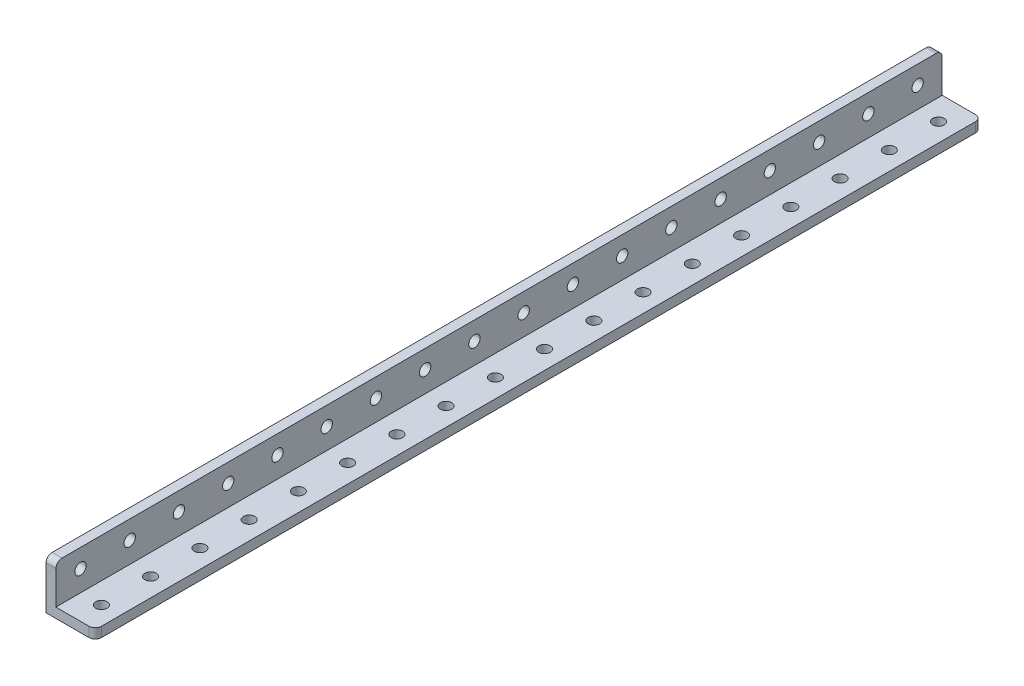
from build123d import *

# Parameters (mm, degrees)
BOSS_EXTRUDE1_DEPTH = 144
SKETCH2_R           = 1.85
CUT_EXTRUDE1_DEPTH  = 146.766937266
CUT_EXTRUDE2_REACH  = 147.45
SKETCH3_R           = 1.85
LPATTERN1_COUNT     = 18
LPATTERN1_PITCH     = 16
FILLET1_R           = 2


with BuildPart() as part:
    # Sketch1 → Boss-Extrude1 (new, symmetric)
    with BuildSketch(Plane.XY):
        Polygon((0, 0), (16, 0), (16, 3.2), (3.2, 3.2), (3.2, 16), (0, 16), align=None)
    extrude(amount=BOSS_EXTRUDE1_DEPTH, both=True)

    # Sketch2 → Cut-Extrude1 (cut, through all)
    with BuildSketch(Plane.ZY):
        with Locations(Location((136, 10, 0), (0, 0, 270))):
            Circle(SKETCH2_R)
    cut_extrude1 = extrude(amount=-CUT_EXTRUDE1_DEPTH, mode=Mode.SUBTRACT)

    # Sketch3 → Cut-Extrude2 (cut, up to next)
    with BuildSketch(Plane(origin=(0, 3.2, 0), x_dir=(1, 0, 0), z_dir=(0, 1, 0)), mode=Mode.PRIVATE) as cut_extrude2_sk1:
        with Locations(Location((10, -136, 0), (0, 0, 180))):
            Circle(SKETCH3_R)
    cut_extrude2_tool1 = extrude(cut_extrude2_sk1.sketch, amount=-CUT_EXTRUDE2_REACH, mode=Mode.PRIVATE) & part.part
    cut_extrude2 = cut_extrude2_tool1.solids().sort_by_distance((10, 3.2, 136))[0]
    add(cut_extrude2, mode=Mode.SUBTRACT)

    # LPattern1: Cut-Extrude1, Cut-Extrude2 ×18
    with Locations(*[(0, 0, -i * LPATTERN1_PITCH) for i in range(1, LPATTERN1_COUNT)]):
        add(cut_extrude1, mode=Mode.SUBTRACT)
        add(cut_extrude2, mode=Mode.SUBTRACT)

    # Fillet1
    fillet1_edges = [part.edges().sort_by_distance(p)[0] for p in [
        (16, 1.6, -144),
        (1.6, 16, -144),
        (1.6, 16, 144),
        (16, 1.6, 144),
    ]]
    fillet(fillet1_edges, radius=FILLET1_R)


solid = part.part
